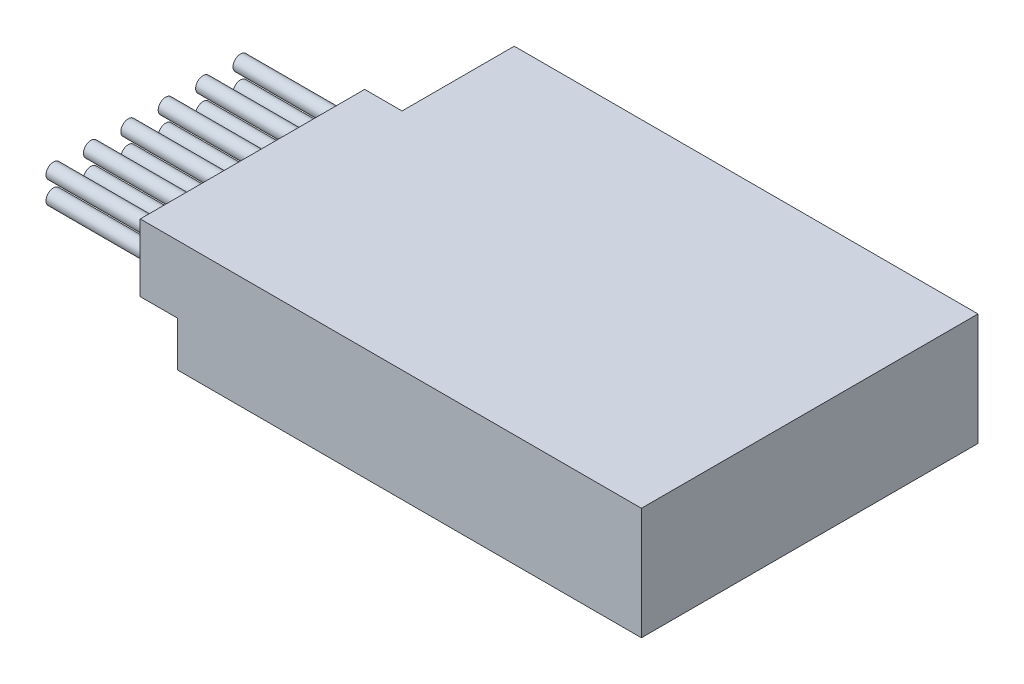
from build123d import *

# Parameters (mm, degrees)
SKETCH1_W           = 31
SKETCH1_H           = 22.5
BOSS_EXTRUDE1_DEPTH = 7.5
SKETCH2_W           = 15
SKETCH2_H           = 4.5
BOSS_EXTRUDE2_DEPTH = 2.5
SKETCH3_R           = 0.5
BOSS_EXTRUDE3_DEPTH = 7


with BuildPart() as part:
    # Sketch1 → Boss-Extrude1 (new body)
    with BuildSketch(Plane(origin=(0, 0, 0), x_dir=(1, 0, 0), z_dir=(0, 1, 0))):
        Rectangle(SKETCH1_W, SKETCH1_H)
    extrude(amount=BOSS_EXTRUDE1_DEPTH)

    # Sketch2 → Boss-Extrude2 (add)
    with BuildSketch(Plane.ZY.offset(15.5)):
        with Locations((3.75, 5.25)):
            Rectangle(SKETCH2_W, SKETCH2_H)
    extrude(amount=BOSS_EXTRUDE2_DEPTH)

    # Sketch3 → Boss-Extrude3 (add)
    with BuildSketch(Plane.ZY.offset(18)):
        with Locations(Location((-2.45, 6.2, 0), (0, 0, 180))):
            Circle(SKETCH3_R)
        with Locations(Location((0.05, 6.2, 0), (0, 0, 180))):
            Circle(SKETCH3_R)
        with Locations(Location((2.55, 6.2, 0), (0, 0, 180))):
            Circle(SKETCH3_R)
        with Locations(Location((5.05, 6.2, 0), (0, 0, 180))):
            Circle(SKETCH3_R)
        with Locations(Location((7.55, 6.2, 0), (0, 0, 180))):
            Circle(SKETCH3_R)
        with Locations(Location((10.05, 6.2, 0), (0, 0, 180))):
            Circle(SKETCH3_R)
        with Locations(Location((-2.45, 4.7, 0), (0, 0, 180))):
            Circle(SKETCH3_R)
        with Locations(Location((0.05, 4.7, 0), (0, 0, 180))):
            Circle(SKETCH3_R)
        with Locations(Location((2.55, 4.7, 0), (0, 0, 180))):
            Circle(SKETCH3_R)
        with Locations(Location((5.05, 4.7, 0), (0, 0, 180))):
            Circle(SKETCH3_R)
        with Locations(Location((7.55, 4.7, 0), (0, 0, 180))):
            Circle(SKETCH3_R)
        with Locations(Location((10.05, 4.7, 0), (0, 0, 180))):
            Circle(SKETCH3_R)
    extrude(amount=BOSS_EXTRUDE3_DEPTH)


solid = part.part
